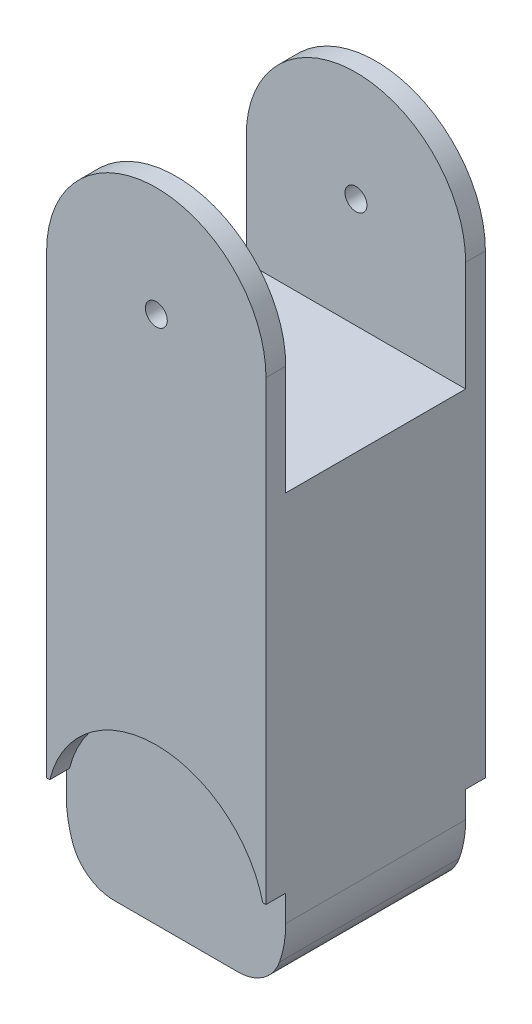
from build123d import *

# Parameters (mm, degrees)
SKETCH1_W               = 50
SKETCH1_H               = 50
BOSS_EXTRUDE1_DEPTH     = 100
CUT_EXTRUDE1_DEPTH      = 4.5
SKETCH4_R               = 2.5
BOSS_EXTRUDE2_DEPTH     = 4.5
CUT_EXTRUDE2_DEPTH      = 159.730116865
CUT_EXTRUDE2_DEPTH_BACK = 159.730116865
FILLET1_R               = 10


with BuildPart() as part:
    # Sketch1 → Boss-Extrude1 (new body)
    with BuildSketch(Plane(origin=(0, 0, 0), x_dir=(1, 0, 0), z_dir=(0, 1, 0))):
        Rectangle(SKETCH1_W, SKETCH1_H)
    extrude(amount=BOSS_EXTRUDE1_DEPTH)

    # Sketch2 → Cut-Extrude1 (cut)
    with BuildSketch(Plane.XY.offset(25)):
        with BuildLine():
            Line((-25, 0), (25, 0))
            Line((25, 0), (25, 21))
            Line((25, 21), (24.269322199, 21))
            ThreePointArc((24.269322199, 21), (0, 40), (-24.269322199, 21))
            Line((-24.269322199, 21), (-25, 21))
            Line((-25, 21), (-25, 0))
        make_face()
    cut_extrude1 = extrude(amount=-CUT_EXTRUDE1_DEPTH, mode=Mode.SUBTRACT)

    # Mirror1: Cut-Extrude1 across plane
    add(cut_extrude1.mirror(Plane.XY), mode=Mode.SUBTRACT)

    # Sketch4 → Boss-Extrude2 (add)
    with BuildSketch(Plane(origin=(0, 0, -25), x_dir=(-1, 0, 0), z_dir=(0, 0, -1))):
        with BuildLine():
            Line((-25, 100), (25, 100))
            Line((25, 100), (25, 125))
            ThreePointArc((25, 125), (0, 150), (-25, 125))
            Line((-25, 125), (-25, 100))
        make_face()
        with Locations((0, 125)):
            Circle(SKETCH4_R, mode=Mode.SUBTRACT)
    boss_extrude2 = extrude(amount=-BOSS_EXTRUDE2_DEPTH)

    # Mirror2: Boss-Extrude2 across plane
    add(boss_extrude2.mirror(Plane.XY))

    # Sketch5 → Cut-Extrude2 (cut, two sides: drawn at the far end of the back side and taken through both)
    with BuildSketch(Plane(origin=(0, 0, -20.5), x_dir=(-1, 0, 0), z_dir=(0, 0, -1)).offset(-CUT_EXTRUDE2_DEPTH_BACK)):
        with BuildLine():
            Line((-25, 15), (-25, -11.716119479))
            Line((-25, -11.716119479), (25, -11.716119479))
            Line((25, -11.716119479), (25, 15))
            ThreePointArc((25, 15), (0, -10), (-25, 15))
        make_face()
    extrude(amount=CUT_EXTRUDE2_DEPTH + CUT_EXTRUDE2_DEPTH_BACK, mode=Mode.SUBTRACT)

    # Fillet1
    fillet1_edges = [part.edges().sort_by_distance(p)[0] for p in [
        (20, 0, 0),
        (-20, 0, 0),
    ]]
    fillet(fillet1_edges, radius=FILLET1_R)


solid = part.part
